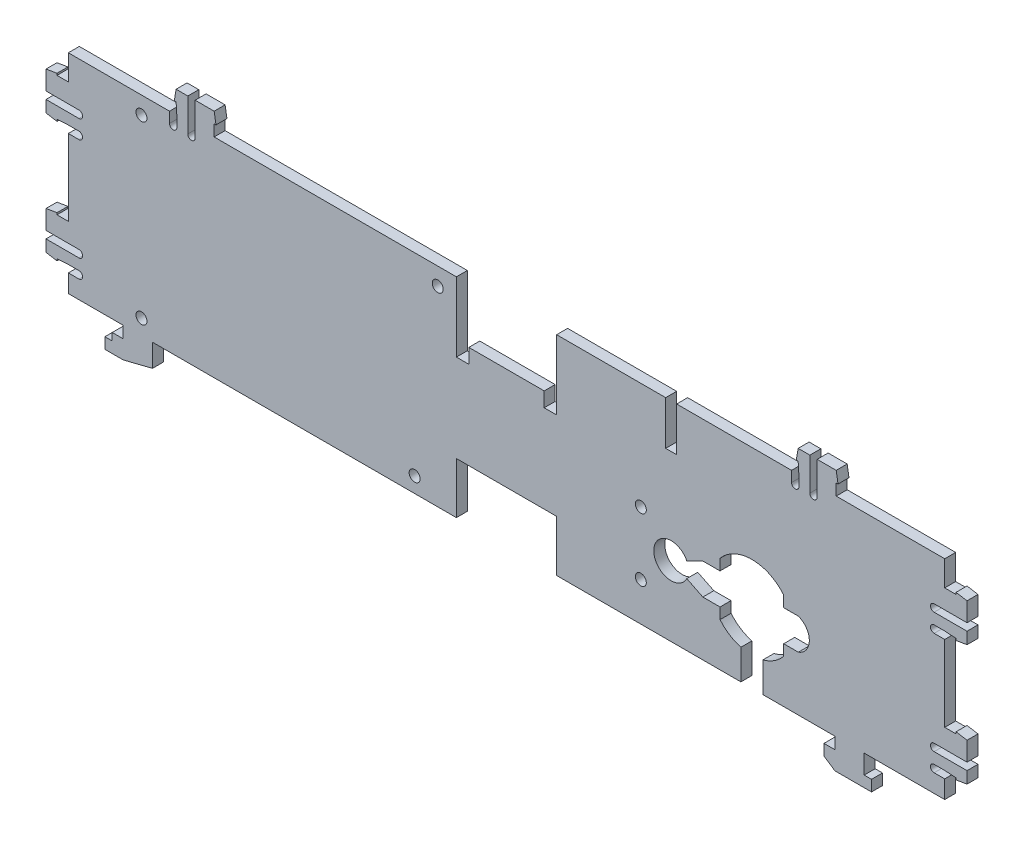
from build123d import *

# Parameters (mm, degrees)
BOSS_EXTRUDE1_DEPTH             = 3
MOTOR_SLOT_REACH                = 135.978
MOTOR_MOUNTING_HOLES_REACH      = 135.978
SKETCH3_R                       = 1.5
ARDUINO_MOUNTING_HOLES_REACH    = 135.978
SKETCH5_R                       = 1.5
FRONT_AND_BACK_PLATE_TABS_DEPTH = 3
FRONT_AND_BACK_TAB_RELIEF_REACH = 141.457
TOP_PLATE_TABS_DEPTH            = 3
TOP_PLATE_TAB_RELIEF_REACH      = 144.188
DRAWSTRING_HOOKS_DEPTH          = 3


with BuildPart() as part:
    # Sketch1 → Boss-Extrude1 (new body)
    with BuildSketch(Plane.XY):
        Polygon((-10.3, 41), (-10.3, 45), (10.3, 45), (10.3, 41), (13.7, 41), (13.7, 60), (43.5, 60), (43.5, 48), (46.5, 48), (46.5, 60), (119.754160418, 60), (119.754160418, 3), (97.754160418, 3), (97.754160418, -3.2), (86.754160418, -3.2), (86.754160418, -0.2), (89.754160418, -0.2), (89.754160418, 3), (13.7, 3), (13.7, 17), (-13.7, 17), (-13.7, 3), (-96.754160418, 3), (-96.754160418, -3.2), (-107.754160418, -3.2), (-107.754160418, -0.2), (-104.754160418, -0.2), (-104.754160418, 3), (-119.754160418, 3), (-119.754160418, 60), (-13.7, 60), (-13.7, 41), align=None)
    extrude(amount=BOSS_EXTRUDE1_DEPTH)

    # Sketch2 → motor slot (cut, up to next)
    with BuildSketch(Plane.XY.offset(3), mode=Mode.PRIVATE) as motor_slot_sk1:
        with BuildLine():
            Line((58.35608, 26.412223996), (53.65708, 26.412223996))
            Line((53.65708, 26.412223996), (49.261506693, 24.248108841))
            ThreePointArc((49.261506693, 24.248108841), (40.25, 22.15), (49.261506693, 20.051891159))
            Line((49.261506693, 20.051891159), (53.65708, 17.887776004))
            Line((53.65708, 17.887776004), (58.35608, 17.887776004))
            Line((58.35608, 17.887776004), (58.35608, 14.887776004))
            ThreePointArc((58.35608, 14.887776004), (60.923183972, 12.608701713), (64.05608, 11.205432351))
            Line((64.05608, 11.205432351), (64.05608, 3))
            Line((64.05608, 3), (70.05608, 3))
            Line((70.05608, 3), (70.05608, 11.205432351))
            ThreePointArc((70.05608, 11.205432351), (73.188976028, 12.608701713), (75.75608, 14.887776004))
            Line((75.75608, 14.887776004), (75.75608, 17.887776004))
            Line((75.75608, 17.887776004), (79.75608, 17.887776004))
            ThreePointArc((79.75608, 17.887776004), (82.75608, 22.15), (79.75608, 26.412223996))
            Line((79.75608, 26.412223996), (75.75608, 26.412223996))
            Line((75.75608, 26.412223996), (75.75608, 29.412223996))
            ThreePointArc((75.75608, 29.412223996), (67.05608, 33.5), (58.35608, 29.412223996))
            Line((58.35608, 29.412223996), (58.35608, 26.412223996))
        make_face()
    motor_slot_tool1 = extrude(motor_slot_sk1.sketch, amount=-MOTOR_SLOT_REACH, mode=Mode.PRIVATE) & part.part
    add(motor_slot_tool1.solids().sort_by_distance((64.026121, 20.923935, 3))[0], mode=Mode.SUBTRACT)

    # Sketch3 → motor mounting holes (cut, up to next)
    with BuildSketch(Plane.XY.offset(3), mode=Mode.PRIVATE) as motor_mounting_holes_sk1:
        with Locations((36.707897475, 13.55)):
            Circle(SKETCH3_R)
    motor_mounting_holes_tool1 = extrude(motor_mounting_holes_sk1.sketch, amount=-MOTOR_MOUNTING_HOLES_REACH, mode=Mode.PRIVATE) & part.part
    # Sketch3 → motor mounting holes (cut, up to next)
    with BuildSketch(Plane.XY.offset(3), mode=Mode.PRIVATE) as motor_mounting_holes_sk2:
        with Locations((36.707897475, 30.75)):
            Circle(SKETCH3_R)
    motor_mounting_holes_tool2 = extrude(motor_mounting_holes_sk2.sketch, amount=-MOTOR_MOUNTING_HOLES_REACH, mode=Mode.PRIVATE) & part.part
    add(motor_mounting_holes_tool1.solids().sort_by_distance((36.707897, 13.55, 3))[0], mode=Mode.SUBTRACT)
    add(motor_mounting_holes_tool2.solids().sort_by_distance((36.707897, 30.75, 3))[0], mode=Mode.SUBTRACT)

    # Sketch5 → Arduino mounting holes (cut, up to next)
    with BuildSketch(Plane(origin=(0, 0, 0), x_dir=(-1, 0, 0), z_dir=(0, 0, -1)), mode=Mode.PRIVATE) as arduino_mounting_holes_sk1:
        with Locations((25.104488458, 7.197745238)):
            Circle(SKETCH5_R)
    arduino_mounting_holes_tool1 = extrude(arduino_mounting_holes_sk1.sketch, amount=-ARDUINO_MOUNTING_HOLES_REACH, mode=Mode.PRIVATE) & part.part
    # Sketch5 → Arduino mounting holes (cut, up to next)
    with BuildSketch(Plane(origin=(0, 0, 0), x_dir=(-1, 0, 0), z_dir=(0, 0, -1)), mode=Mode.PRIVATE) as arduino_mounting_holes_sk2:
        with Locations((99.768438844, 7.197745238)):
            Circle(SKETCH5_R)
    arduino_mounting_holes_tool2 = extrude(arduino_mounting_holes_sk2.sketch, amount=-ARDUINO_MOUNTING_HOLES_REACH, mode=Mode.PRIVATE) & part.part
    # Sketch5 → Arduino mounting holes (cut, up to next)
    with BuildSketch(Plane(origin=(0, 0, 0), x_dir=(-1, 0, 0), z_dir=(0, 0, -1)), mode=Mode.PRIVATE) as arduino_mounting_holes_sk3:
        with Locations((99.768438844, 55.228881858)):
            Circle(SKETCH5_R)
    arduino_mounting_holes_tool3 = extrude(arduino_mounting_holes_sk3.sketch, amount=-ARDUINO_MOUNTING_HOLES_REACH, mode=Mode.PRIVATE) & part.part
    # Sketch5 → Arduino mounting holes (cut, up to next)
    with BuildSketch(Plane(origin=(0, 0, 0), x_dir=(-1, 0, 0), z_dir=(0, 0, -1)), mode=Mode.PRIVATE) as arduino_mounting_holes_sk4:
        with Locations((18.797071777, 55.228881858)):
            Circle(SKETCH5_R)
    arduino_mounting_holes_tool4 = extrude(arduino_mounting_holes_sk4.sketch, amount=-ARDUINO_MOUNTING_HOLES_REACH, mode=Mode.PRIVATE) & part.part
    add(arduino_mounting_holes_tool1.solids().sort_by_distance((-25.104488, 7.197745, 0))[0], mode=Mode.SUBTRACT)
    add(arduino_mounting_holes_tool2.solids().sort_by_distance((-99.768439, 7.197745, 0))[0], mode=Mode.SUBTRACT)
    add(arduino_mounting_holes_tool3.solids().sort_by_distance((-99.768439, 55.228882, 0))[0], mode=Mode.SUBTRACT)
    add(arduino_mounting_holes_tool4.solids().sort_by_distance((-18.797072, 55.228882, 0))[0], mode=Mode.SUBTRACT)

    # Sketch4 → front and back plate tabs (add)
    with BuildSketch(Plane(origin=(0, 0, 0), x_dir=(-1, 0, 0), z_dir=(0, 0, -1))):
        with BuildLine():
            Line((122.854160418, 42.7), (119.754160418, 42.9))
            Line((119.754160418, 42.9), (116.854160418, 42.9))
            ThreePointArc((116.854160418, 42.9), (115.854160418, 41.9), (116.854160418, 40.9))
            Line((116.854160418, 40.9), (119.754160418, 40.9))
            Line((119.754160418, 40.9), (119.754160418, 38.9))
            Line((119.754160418, 38.9), (112.754160418, 38.9))
            Line((112.754160418, 38.9), (112.754160418, 55.1))
            Line((112.754160418, 55.1), (119.754160418, 55.1))
            Line((119.754160418, 55.1), (119.754160418, 53.1))
            Line((119.754160418, 53.1), (122.854160418, 53.1))
            Line((122.854160418, 53.1), (122.854160418, 53.6))
            Line((122.854160418, 53.6), (125.854160418, 53.1))
            Line((125.854160418, 53.1), (125.854160418, 47.9))
            Line((125.854160418, 47.9), (116.854160418, 47.9))
            ThreePointArc((116.854160418, 47.9), (115.854160418, 46.9), (116.854160418, 45.9))
            Line((116.854160418, 45.9), (125.854160418, 45.9))
            Line((125.854160418, 45.9), (125.854160418, 42.7))
            Line((125.854160418, 42.7), (122.854160418, 42.2))
            Line((122.854160418, 42.2), (122.854160418, 42.7))
        make_face()
        with BuildLine():
            Line((122.854160418, 9.7), (119.754160418, 9.9))
            Line((119.754160418, 9.9), (116.854160418, 9.9))
            ThreePointArc((116.854160418, 9.9), (115.854160418, 8.9), (116.854160418, 7.9))
            Line((116.854160418, 7.9), (119.754160418, 7.9))
            Line((119.754160418, 7.9), (119.754160418, 5.9))
            Line((119.754160418, 5.9), (112.754160418, 5.9))
            Line((112.754160418, 5.9), (112.754160418, 22.1))
            Line((112.754160418, 22.1), (119.754160418, 22.1))
            Line((119.754160418, 22.1), (119.754160418, 20.1))
            Line((119.754160418, 20.1), (122.854160418, 20.1))
            Line((122.854160418, 20.1), (122.854160418, 20.6))
            Line((122.854160418, 20.6), (125.854160418, 20.1))
            Line((125.854160418, 20.1), (125.854160418, 14.9))
            Line((125.854160418, 14.9), (116.854160418, 14.9))
            ThreePointArc((116.854160418, 14.9), (115.854160418, 13.9), (116.854160418, 12.9))
            Line((116.854160418, 12.9), (125.854160418, 12.9))
            Line((125.854160418, 12.9), (125.854160418, 9.7))
            Line((125.854160418, 9.7), (122.854160418, 9.2))
            Line((122.854160418, 9.2), (122.854160418, 9.7))
        make_face()
        with BuildLine():
            Line((-122.854160418, 9.7), (-119.754160418, 9.9))
            Line((-119.754160418, 9.9), (-116.854160418, 9.9))
            ThreePointArc((-116.854160418, 9.9), (-115.854160418, 8.9), (-116.854160418, 7.9))
            Line((-116.854160418, 7.9), (-119.754160418, 7.9))
            Line((-119.754160418, 7.9), (-119.754160418, 5.9))
            Line((-119.754160418, 5.9), (-112.754160418, 5.9))
            Line((-112.754160418, 5.9), (-112.754160418, 22.1))
            Line((-112.754160418, 22.1), (-119.754160418, 22.1))
            Line((-119.754160418, 22.1), (-119.754160418, 20.1))
            Line((-119.754160418, 20.1), (-122.854160418, 20.1))
            Line((-122.854160418, 20.1), (-122.854160418, 20.6))
            Line((-122.854160418, 20.6), (-125.854160418, 20.1))
            Line((-125.854160418, 20.1), (-125.854160418, 14.9))
            Line((-125.854160418, 14.9), (-116.854160418, 14.9))
            ThreePointArc((-116.854160418, 14.9), (-115.854160418, 13.9), (-116.854160418, 12.9))
            Line((-116.854160418, 12.9), (-125.854160418, 12.9))
            Line((-125.854160418, 12.9), (-125.854160418, 9.7))
            Line((-125.854160418, 9.7), (-122.854160418, 9.2))
            Line((-122.854160418, 9.2), (-122.854160418, 9.7))
        make_face()
        with BuildLine():
            Line((-122.854160418, 42.7), (-119.754160418, 42.9))
            Line((-119.754160418, 42.9), (-116.854160418, 42.9))
            ThreePointArc((-116.854160418, 42.9), (-115.854160418, 41.9), (-116.854160418, 40.9))
            Line((-116.854160418, 40.9), (-119.754160418, 40.9))
            Line((-119.754160418, 40.9), (-119.754160418, 38.9))
            Line((-119.754160418, 38.9), (-112.754160418, 38.9))
            Line((-112.754160418, 38.9), (-112.754160418, 55.1))
            Line((-112.754160418, 55.1), (-119.754160418, 55.1))
            Line((-119.754160418, 55.1), (-119.754160418, 53.1))
            Line((-119.754160418, 53.1), (-122.854160418, 53.1))
            Line((-122.854160418, 53.1), (-122.854160418, 53.6))
            Line((-122.854160418, 53.6), (-125.854160418, 53.1))
            Line((-125.854160418, 53.1), (-125.854160418, 47.9))
            Line((-125.854160418, 47.9), (-116.854160418, 47.9))
            ThreePointArc((-116.854160418, 47.9), (-115.854160418, 46.9), (-116.854160418, 45.9))
            Line((-116.854160418, 45.9), (-125.854160418, 45.9))
            Line((-125.854160418, 45.9), (-125.854160418, 42.7))
            Line((-125.854160418, 42.7), (-122.854160418, 42.2))
            Line((-122.854160418, 42.2), (-122.854160418, 42.7))
        make_face()
    extrude(amount=-FRONT_AND_BACK_PLATE_TABS_DEPTH)

    # Sketch6 → front and back tab relief (cut, up to next)
    with BuildSketch(Plane(origin=(0, 0, 0), x_dir=(-1, 0, 0), z_dir=(0, 0, -1)), mode=Mode.PRIVATE) as front_and_back_tab_relief_sk1:
        with BuildLine():
            Line((116.854160418, 45.9), (125.854160418, 45.9))
            Line((125.854160418, 45.9), (125.854160418, 47.9))
            Line((125.854160418, 47.9), (116.854160418, 47.9))
            ThreePointArc((116.854160418, 47.9), (115.854160418, 46.9), (116.854160418, 45.9))
        make_face()
    front_and_back_tab_relief_tool1 = extrude(front_and_back_tab_relief_sk1.sketch, amount=-FRONT_AND_BACK_TAB_RELIEF_REACH, mode=Mode.PRIVATE) & part.part
    # Sketch6 → front and back tab relief (cut, up to next)
    with BuildSketch(Plane(origin=(0, 0, 0), x_dir=(-1, 0, 0), z_dir=(0, 0, -1)), mode=Mode.PRIVATE) as front_and_back_tab_relief_sk2:
        with BuildLine():
            Line((119.754160418, 42.9), (116.854160418, 42.9))
            ThreePointArc((116.854160418, 42.9), (115.854160418, 41.9), (116.854160418, 40.9))
            Line((116.854160418, 40.9), (119.754160418, 40.9))
            Line((119.754160418, 40.9), (119.754160418, 42.9))
        make_face()
    front_and_back_tab_relief_tool2 = extrude(front_and_back_tab_relief_sk2.sketch, amount=-FRONT_AND_BACK_TAB_RELIEF_REACH, mode=Mode.PRIVATE) & part.part
    # Sketch6 → front and back tab relief (cut, up to next)
    with BuildSketch(Plane(origin=(0, 0, 0), x_dir=(-1, 0, 0), z_dir=(0, 0, -1)), mode=Mode.PRIVATE) as front_and_back_tab_relief_sk3:
        with BuildLine():
            Line((116.854160418, 12.9), (125.854160418, 12.9))
            Line((125.854160418, 12.9), (125.854160418, 14.9))
            Line((125.854160418, 14.9), (116.854160418, 14.9))
            ThreePointArc((116.854160418, 14.9), (115.854160418, 13.9), (116.854160418, 12.9))
        make_face()
    front_and_back_tab_relief_tool3 = extrude(front_and_back_tab_relief_sk3.sketch, amount=-FRONT_AND_BACK_TAB_RELIEF_REACH, mode=Mode.PRIVATE) & part.part
    # Sketch6 → front and back tab relief (cut, up to next)
    with BuildSketch(Plane(origin=(0, 0, 0), x_dir=(-1, 0, 0), z_dir=(0, 0, -1)), mode=Mode.PRIVATE) as front_and_back_tab_relief_sk4:
        with BuildLine():
            Line((119.754160418, 9.9), (116.854160418, 9.9))
            ThreePointArc((116.854160418, 9.9), (115.854160418, 8.9), (116.854160418, 7.9))
            Line((116.854160418, 7.9), (119.754160418, 7.9))
            Line((119.754160418, 7.9), (119.754160418, 9.9))
        make_face()
    front_and_back_tab_relief_tool4 = extrude(front_and_back_tab_relief_sk4.sketch, amount=-FRONT_AND_BACK_TAB_RELIEF_REACH, mode=Mode.PRIVATE) & part.part
    # Sketch6 → front and back tab relief (cut, up to next)
    with BuildSketch(Plane(origin=(0, 0, 0), x_dir=(-1, 0, 0), z_dir=(0, 0, -1)), mode=Mode.PRIVATE) as front_and_back_tab_relief_sk5:
        with BuildLine():
            Line((-125.854160418, 12.9), (-125.854160418, 14.9))
            Line((-125.854160418, 14.9), (-116.854160418, 14.9))
            ThreePointArc((-116.854160418, 14.9), (-115.854160418, 13.9), (-116.854160418, 12.9))
            Line((-116.854160418, 12.9), (-125.854160418, 12.9))
        make_face()
    front_and_back_tab_relief_tool5 = extrude(front_and_back_tab_relief_sk5.sketch, amount=-FRONT_AND_BACK_TAB_RELIEF_REACH, mode=Mode.PRIVATE) & part.part
    # Sketch6 → front and back tab relief (cut, up to next)
    with BuildSketch(Plane(origin=(0, 0, 0), x_dir=(-1, 0, 0), z_dir=(0, 0, -1)), mode=Mode.PRIVATE) as front_and_back_tab_relief_sk6:
        with BuildLine():
            Line((-119.754160418, 7.9), (-119.754160418, 9.9))
            Line((-119.754160418, 9.9), (-116.854160418, 9.9))
            ThreePointArc((-116.854160418, 9.9), (-115.854160418, 8.9), (-116.854160418, 7.9))
            Line((-116.854160418, 7.9), (-119.754160418, 7.9))
        make_face()
    front_and_back_tab_relief_tool6 = extrude(front_and_back_tab_relief_sk6.sketch, amount=-FRONT_AND_BACK_TAB_RELIEF_REACH, mode=Mode.PRIVATE) & part.part
    # Sketch6 → front and back tab relief (cut, up to next)
    with BuildSketch(Plane(origin=(0, 0, 0), x_dir=(-1, 0, 0), z_dir=(0, 0, -1)), mode=Mode.PRIVATE) as front_and_back_tab_relief_sk7:
        with BuildLine():
            Line((-125.854160418, 47.9), (-125.854160418, 45.9))
            Line((-125.854160418, 45.9), (-116.854160418, 45.9))
            ThreePointArc((-116.854160418, 45.9), (-115.854160418, 46.9), (-116.854160418, 47.9))
            Line((-116.854160418, 47.9), (-125.854160418, 47.9))
        make_face()
    front_and_back_tab_relief_tool7 = extrude(front_and_back_tab_relief_sk7.sketch, amount=-FRONT_AND_BACK_TAB_RELIEF_REACH, mode=Mode.PRIVATE) & part.part
    # Sketch6 → front and back tab relief (cut, up to next)
    with BuildSketch(Plane(origin=(0, 0, 0), x_dir=(-1, 0, 0), z_dir=(0, 0, -1)), mode=Mode.PRIVATE) as front_and_back_tab_relief_sk8:
        with BuildLine():
            Line((-119.754160418, 42.9), (-119.754160418, 40.9))
            Line((-119.754160418, 40.9), (-116.854160418, 40.9))
            ThreePointArc((-116.854160418, 40.9), (-115.854160418, 41.9), (-116.854160418, 42.9))
            Line((-116.854160418, 42.9), (-119.754160418, 42.9))
        make_face()
    front_and_back_tab_relief_tool8 = extrude(front_and_back_tab_relief_sk8.sketch, amount=-FRONT_AND_BACK_TAB_RELIEF_REACH, mode=Mode.PRIVATE) & part.part
    add(front_and_back_tab_relief_tool1.solids().sort_by_distance((-120.958916, 46.9, 0))[0], mode=Mode.SUBTRACT)
    add(front_and_back_tab_relief_tool2.solids().sort_by_distance((-117.904703, 41.9, 0))[0], mode=Mode.SUBTRACT)
    add(front_and_back_tab_relief_tool3.solids().sort_by_distance((-120.958916, 13.9, 0))[0], mode=Mode.SUBTRACT)
    add(front_and_back_tab_relief_tool4.solids().sort_by_distance((-117.904703, 8.9, 0))[0], mode=Mode.SUBTRACT)
    add(front_and_back_tab_relief_tool5.solids().sort_by_distance((120.958916, 13.9, 0))[0], mode=Mode.SUBTRACT)
    add(front_and_back_tab_relief_tool6.solids().sort_by_distance((117.904703, 8.9, 0))[0], mode=Mode.SUBTRACT)
    add(front_and_back_tab_relief_tool7.solids().sort_by_distance((120.958916, 46.9, 0))[0], mode=Mode.SUBTRACT)
    add(front_and_back_tab_relief_tool8.solids().sort_by_distance((117.904703, 41.9, 0))[0], mode=Mode.SUBTRACT)

    # Sketch7 → top plate tabs (add)
    with BuildSketch(Plane(origin=(0, 0, 0), x_dir=(-1, 0, 0), z_dir=(0, 0, -1))):
        with BuildLine():
            Line((90.3, 63.1), (90.1, 60))
            Line((90.1, 60), (90.1, 57.1))
            ThreePointArc((90.1, 57.1), (91.1, 56.1), (92.1, 57.1))
            Line((92.1, 57.1), (92.1, 60))
            Line((92.1, 60), (94.1, 60))
            Line((94.1, 60), (94.1, 53))
            Line((94.1, 53), (77.9, 53))
            Line((77.9, 53), (77.9, 60))
            Line((77.9, 60), (79.9, 60))
            Line((79.9, 60), (79.9, 63.1))
            Line((79.9, 63.1), (79.4, 63.1))
            Line((79.4, 63.1), (79.9, 66.1))
            Line((79.9, 66.1), (85.1, 66.1))
            Line((85.1, 66.1), (85.1, 57.1))
            ThreePointArc((85.1, 57.1), (86.1, 56.1), (87.1, 57.1))
            Line((87.1, 57.1), (87.1, 66.1))
            Line((87.1, 66.1), (90.3, 66.1))
            Line((90.3, 66.1), (90.8, 63.1))
            Line((90.8, 63.1), (90.3, 63.1))
        make_face()
        with BuildLine():
            Line((-79.7, 63.1), (-79.9, 60))
            Line((-79.9, 60), (-79.9, 57.1))
            ThreePointArc((-79.9, 57.1), (-78.9, 56.1), (-77.9, 57.1))
            Line((-77.9, 57.1), (-77.9, 60))
            Line((-77.9, 60), (-75.9, 60))
            Line((-75.9, 60), (-75.9, 53))
            Line((-75.9, 53), (-92.1, 53))
            Line((-92.1, 53), (-92.1, 60))
            Line((-92.1, 60), (-90.1, 60))
            Line((-90.1, 60), (-90.1, 63.1))
            Line((-90.1, 63.1), (-90.6, 63.1))
            Line((-90.6, 63.1), (-90.1, 66.1))
            Line((-90.1, 66.1), (-84.9, 66.1))
            Line((-84.9, 66.1), (-84.9, 57.1))
            ThreePointArc((-84.9, 57.1), (-83.9, 56.1), (-82.9, 57.1))
            Line((-82.9, 57.1), (-82.9, 66.1))
            Line((-82.9, 66.1), (-79.7, 66.1))
            Line((-79.7, 66.1), (-79.2, 63.1))
            Line((-79.2, 63.1), (-79.7, 63.1))
        make_face()
    extrude(amount=-TOP_PLATE_TABS_DEPTH)

    # Sketch8 → top plate tab relief (cut, up to next)
    with BuildSketch(Plane(origin=(0, 0, 0), x_dir=(-1, 0, 0), z_dir=(0, 0, -1)), mode=Mode.PRIVATE) as top_plate_tab_relief_sk1:
        with BuildLine():
            Line((-84.9, 66.1), (-84.9, 57.1))
            ThreePointArc((-84.9, 57.1), (-83.9, 56.1), (-82.9, 57.1))
            Line((-82.9, 57.1), (-82.9, 66.1))
            Line((-82.9, 66.1), (-84.9, 66.1))
        make_face()
    top_plate_tab_relief_tool1 = extrude(top_plate_tab_relief_sk1.sketch, amount=-TOP_PLATE_TAB_RELIEF_REACH, mode=Mode.PRIVATE) & part.part
    # Sketch8 → top plate tab relief (cut, up to next)
    with BuildSketch(Plane(origin=(0, 0, 0), x_dir=(-1, 0, 0), z_dir=(0, 0, -1)), mode=Mode.PRIVATE) as top_plate_tab_relief_sk2:
        with BuildLine():
            Line((-79.9, 60), (-79.9, 57.1))
            ThreePointArc((-79.9, 57.1), (-78.9, 56.1), (-77.9, 57.1))
            Line((-77.9, 57.1), (-77.9, 60))
            Line((-77.9, 60), (-79.9, 60))
        make_face()
    top_plate_tab_relief_tool2 = extrude(top_plate_tab_relief_sk2.sketch, amount=-TOP_PLATE_TAB_RELIEF_REACH, mode=Mode.PRIVATE) & part.part
    # Sketch8 → top plate tab relief (cut, up to next)
    with BuildSketch(Plane(origin=(0, 0, 0), x_dir=(-1, 0, 0), z_dir=(0, 0, -1)), mode=Mode.PRIVATE) as top_plate_tab_relief_sk3:
        with BuildLine():
            Line((85.1, 66.1), (85.1, 57.1))
            ThreePointArc((85.1, 57.1), (86.1, 56.1), (87.1, 57.1))
            Line((87.1, 57.1), (87.1, 66.1))
            Line((87.1, 66.1), (85.1, 66.1))
        make_face()
    top_plate_tab_relief_tool3 = extrude(top_plate_tab_relief_sk3.sketch, amount=-TOP_PLATE_TAB_RELIEF_REACH, mode=Mode.PRIVATE) & part.part
    # Sketch8 → top plate tab relief (cut, up to next)
    with BuildSketch(Plane(origin=(0, 0, 0), x_dir=(-1, 0, 0), z_dir=(0, 0, -1)), mode=Mode.PRIVATE) as top_plate_tab_relief_sk4:
        with BuildLine():
            Line((90.1, 60), (90.1, 57.1))
            ThreePointArc((90.1, 57.1), (91.1, 56.1), (92.1, 57.1))
            Line((92.1, 57.1), (92.1, 60))
            Line((92.1, 60), (90.1, 60))
        make_face()
    top_plate_tab_relief_tool4 = extrude(top_plate_tab_relief_sk4.sketch, amount=-TOP_PLATE_TAB_RELIEF_REACH, mode=Mode.PRIVATE) & part.part
    add(top_plate_tab_relief_tool1.solids().sort_by_distance((83.9, 61.204755, 0))[0], mode=Mode.SUBTRACT)
    add(top_plate_tab_relief_tool2.solids().sort_by_distance((78.9, 58.150542, 0))[0], mode=Mode.SUBTRACT)
    add(top_plate_tab_relief_tool3.solids().sort_by_distance((-86.1, 61.204755, 0))[0], mode=Mode.SUBTRACT)
    add(top_plate_tab_relief_tool4.solids().sort_by_distance((-91.1, 58.150542, 0))[0], mode=Mode.SUBTRACT)

    # Sketch9 → drawstring hooks (add)
    with BuildSketch(Plane(origin=(0, 0, 0), x_dir=(-1, 0, 0), z_dir=(0, 0, -1))):
        Polygon((107.754160418, -2.2), (109.754160418, -2.2), (109.754160418, -5.2), (104.754160418, -5.2), (96.754160418, -3.2), (107.754160418, -3.2), align=None)
        Polygon((-97.754160418, -2.2), (-99.754160418, -2.2), (-99.754160418, -5.2), (-89.754160418, -5.2), (-86.754160418, -3.2), (-97.754160418, -3.2), align=None)
    extrude(amount=-DRAWSTRING_HOOKS_DEPTH)


solid = part.part
